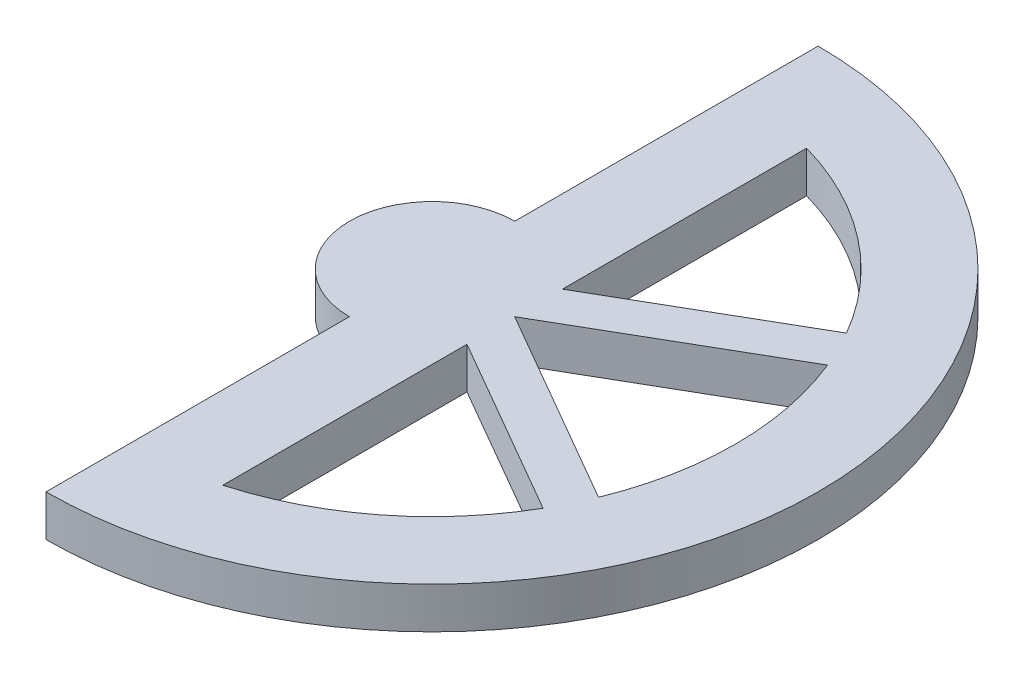
from build123d import *

# Parameters (mm, degrees)
BOSS_EXTRUDE1_DEPTH = 3.175


with BuildPart() as part:
    # Sketch1 → Boss-Extrude1 (new body)
    with BuildSketch(Plane(origin=(0, 0, 0), x_dir=(1, 0, 0), z_dir=(0, 1, 0))):
        with BuildLine():
            Line((0, 29.6545), (0, 6.35))
            ThreePointArc((0, 6.35), (-6.35, 0), (0, -6.35))
            Line((0, -6.35), (0, -29.6545))
            ThreePointArc((0, -29.6545), (29.6545, 0), (0, 29.6545))
        make_face()
        with BuildLine():
            Line((6.35, 22.422694313), (6.35, 3.666174209))
            Line((6.35, 3.666174209), (20.182289022, 11.65225))
            ThreePointArc((20.182289022, 11.65225), (14.317514025, 18.387727222), (6.35, 22.422694313))
        make_face(mode=Mode.SUBTRACT)
        with BuildLine():
            Line((6.35, 0), (21.581607168, -8.793972499))
            ThreePointArc((21.581607168, -8.793972499), (23.3045, 0), (21.581607168, 8.793972499))
            Line((21.581607168, 8.793972499), (6.35, 0))
        make_face(mode=Mode.SUBTRACT)
        with BuildLine():
            Line((6.35, -3.666174209), (20.182289022, -11.65225))
            ThreePointArc((20.182289022, -11.65225), (14.317514025, -18.387727222), (6.35, -22.422694313))
            Line((6.35, -22.422694313), (6.35, -3.666174209))
        make_face(mode=Mode.SUBTRACT)
    extrude(amount=BOSS_EXTRUDE1_DEPTH)


solid = part.part
